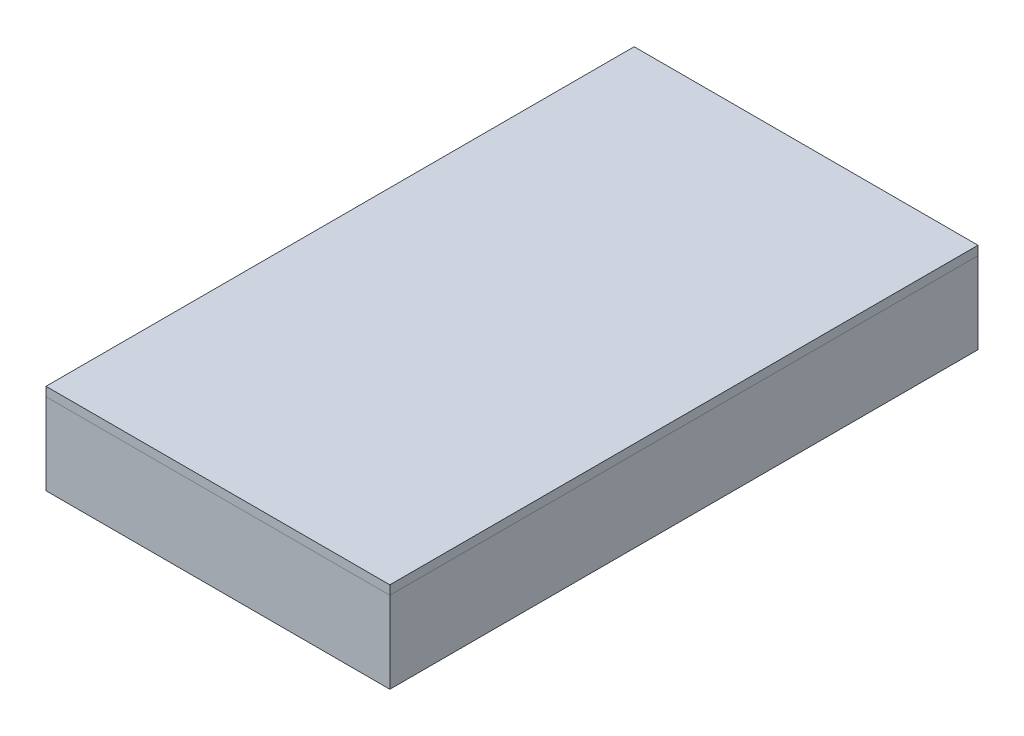
from build123d import *

# Parameters (mm, degrees)
SKETCH3_W           = 38
SKETCH3_H           = 65
BOSS_EXTRUDE1_DEPTH = 0.64
SKETCH3_3_W         = 38
SKETCH3_3_H         = 65
BOSS_EXTRUDE2_DEPTH = 10
SKETCH6_R           = 2.5
BOSS_EXTRUDE3_DEPTH = 3
SKETCH6_3_R         = 2.6
SKETCH6_3_R_2       = 2.5
CUT_EXTRUDE2_DEPTH  = 4
CUT_EXTRUDE1_START  = -10
SKETCH5_R           = 1.45
CUT_EXTRUDE1_DEPTH  = 6


with BuildPart() as part:
    # Sketch3 → Boss-Extrude1 (new body)
    with BuildSketch(Plane(origin=(0, 0, 0), x_dir=(1, 0, 0), z_dir=(0, 1, 0))):
        Rectangle(SKETCH3_W, SKETCH3_H)
    extrude(amount=-BOSS_EXTRUDE1_DEPTH)

    # Sketch3<3> → Boss-Extrude2 (add)
    with BuildSketch(Plane(origin=(0, 0, 0), x_dir=(1, 0, 0), z_dir=(0, 1, 0))):
        Rectangle(SKETCH3_3_W, SKETCH3_3_H)
        with BuildLine():
            Line((-15.806141704, 3.169555117), (-14.563388627, 23.488388316))
            ThreePointArc((-14.563388627, 23.488388316), (-13.982347964, 26.029888674), (-12.614994756, 28.249613324))
            Line((-12.614994756, 28.249613324), (-6.645362379, 21.903707215))
            Line((-6.645362379, 21.903707215), (-7.681935248, 4.955890615))
            Line((-7.681935248, 4.955890615), (-12.929312113, 1.001708527))
            Line((-12.929312113, 1.001708527), (-15.806141704, 3.169555117))
        make_face(mode=Mode.SUBTRACT)
        with BuildLine():
            Line((-11.449601204, 29.345906109), (-5.479968827, 23))
            Line((-5.479968827, 23), (8.001249484, 23))
            Line((8.001249484, 23), (11.371462409, 30.939724094))
            ThreePointArc((11.371462409, 30.939724094), (10.91413207, 30.984914769), (10.454822074, 31))
            Line((10.454822074, 31), (-6.57831024, 31))
            ThreePointArc((-6.57831024, 31), (-9.150541871, 30.57519798), (-11.449601204, 29.345906109))
        make_face(mode=Mode.SUBTRACT)
        Polygon((-11.6, 0), (-6.291820714, 4), (6.291820714, 4), (11.6, 0), (6.291820714, -4), (-6.291820714, -4), align=None, mode=Mode.SUBTRACT)
        with BuildLine():
            Line((9.333267306, 22.043149873), (12.941431756, 30.543452628))
            ThreePointArc((12.941431756, 30.543452628), (16.335726731, 27.796703889), (17.441765663, 23.572660223))
            Line((17.441765663, 23.572660223), (16.212591289, 3.475836847))
            Line((16.212591289, 3.475836847), (12.929312113, 1.001708527))
            Line((12.929312113, 1.001708527), (8.261456028, 4.519190384))
            Line((8.261456028, 4.519190384), (9.333267306, 22.043149873))
        make_face(mode=Mode.SUBTRACT)
        with BuildLine():
            Line((6.62830762, -22.182550065), (7.681935248, -4.955890615))
            Line((7.681935248, -4.955890615), (12.929312113, -1.001708527))
            Line((12.929312113, -1.001708527), (15.806141704, -3.169555117))
            Line((15.806141704, -3.169555117), (14.563388627, -23.488388316))
            ThreePointArc((14.563388627, -23.488388316), (13.062425539, -27.685749543), (9.548273172, -30.428278413))
            Line((9.548273172, -30.428278413), (6.62830762, -22.182550065))
        make_face(mode=Mode.SUBTRACT)
        with BuildLine():
            Line((8.007780574, -30.871252414), (5.220423905, -23))
            Line((5.220423905, -23), (-8.224219459, -23))
            Line((-8.224219459, -23), (-14.971866072, -29.347552106))
            ThreePointArc((-14.971866072, -29.347552106), (-12.859726985, -30.573920624), (-10.454822074, -31))
            Line((-10.454822074, -31), (6.57831024, -31))
            ThreePointArc((6.57831024, -31), (7.295938517, -30.967748092), (8.007780574, -30.871252414))
        make_face(mode=Mode.SUBTRACT)
        with BuildLine():
            Line((-16.068158856, -28.182158554), (-9.320512244, -21.834606448))
            Line((-9.320512244, -21.834606448), (-8.261456028, -4.519190384))
            Line((-8.261456028, -4.519190384), (-12.929312113, -1.001708527))
            Line((-12.929312113, -1.001708527), (-16.212591289, -3.475836847))
            Line((-16.212591289, -3.475836847), (-17.441765663, -23.572660223))
            ThreePointArc((-17.441765663, -23.572660223), (-17.163296944, -25.999091025), (-16.068158856, -28.182158554))
        make_face(mode=Mode.SUBTRACT)
    extrude(amount=-BOSS_EXTRUDE2_DEPTH)


with BuildPart() as body_2:
    # Split1: the piece on the far side of the plane
    add(part.part)
    split(bisect_by=Plane.ZX.offset(-1), keep=Keep.BOTTOM)

    # Sketch6<3> → Cut-Extrude2 (cut)
    # profile 1 of 4: a face of its own
    with BuildSketch(Plane(origin=(0, 0, 0), x_dir=(1, 0, 0), z_dir=(0, 1, 0))):
        with Locations(Location((0.825695372, 13.5, 0), (0, 0, 270))):
            Circle(SKETCH6_3_R)
        with Locations(Location((0.825695372, 13.5, 0), (0, 0, 270))):
            Circle(SKETCH6_3_R_2, mode=Mode.SUBTRACT)
    # profile 2 of 4: a face of its own
    with BuildSketch(Plane(origin=(0, 0, 0), x_dir=(1, 0, 0), z_dir=(0, 1, 0))):
        with Locations(Location((0.825695372, 13.5, 0), (0, 0, 270))):
            Circle(SKETCH6_3_R_2)
    # profile 3 of 4: a face of its own
    with BuildSketch(Plane(origin=(0, 0, 0), x_dir=(1, 0, 0), z_dir=(0, 1, 0))):
        with Locations(Location((-0.825695372, -13.5, 0), (0, 0, 270))):
            Circle(SKETCH6_3_R)
        with Locations(Location((-0.825695372, -13.5, 0), (0, 0, 270))):
            Circle(SKETCH6_3_R_2, mode=Mode.SUBTRACT)
    # profile 4 of 4: a face of its own
    with BuildSketch(Plane(origin=(0, 0, 0), x_dir=(1, 0, 0), z_dir=(0, 1, 0))):
        with Locations(Location((-0.825695372, -13.5, 0), (0, 0, 270))):
            Circle(SKETCH6_3_R_2)
    extrude(amount=-CUT_EXTRUDE2_DEPTH, mode=Mode.SUBTRACT)

    # Sketch5 → Cut-Extrude1 (cut)
    with BuildSketch(Plane(origin=(0, 0, 0), x_dir=(1, 0, 0), z_dir=(0, 1, 0)).offset(CUT_EXTRUDE1_START)):
        with Locations(Location((-16, 29.5, 0), (0, 0, 90))):
            Circle(SKETCH5_R)
        with Locations(Location((16, -29.5, 0), (0, 0, 90))):
            Circle(SKETCH5_R)
    extrude(amount=CUT_EXTRUDE1_DEPTH, mode=Mode.SUBTRACT)


with BuildPart() as part_1:
    add(part.part)

    # Split1
    split(bisect_by=Plane.ZX.offset(-1), keep=Keep.TOP)

    # Sketch6 → Boss-Extrude3 (add)
    with BuildSketch(Plane(origin=(0, 0, 0), x_dir=(1, 0, 0), z_dir=(0, 1, 0))):
        with Locations(Location((0.825695372, 13.5, 0), (0, 0, 270))):
            Circle(SKETCH6_R)
        with Locations(Location((-0.825695372, -13.5, 0), (0, 0, 270))):
            Circle(SKETCH6_R)
    extrude(amount=-BOSS_EXTRUDE3_DEPTH)


solid = Compound([body_2.part, part_1.part])
